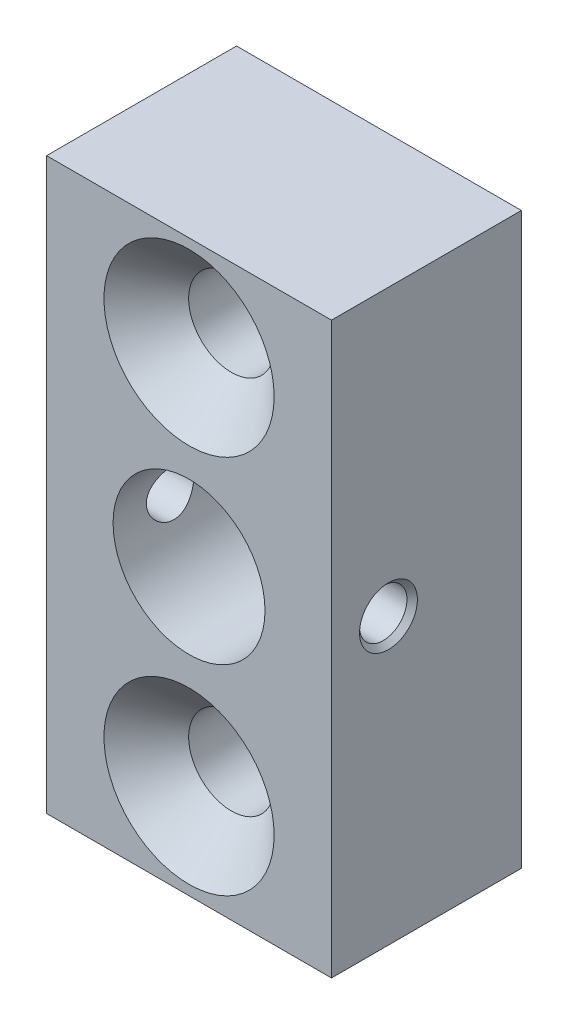
from build123d import *

# Parameters (mm, degrees)
SKIZZE1_W                             = 15
SKIZZE1_H                             = 30
AUFSATZ_LINEAR_AUSTRAGEN1_DEPTH       = 10
FORMSENKUNG_F_R_M4_SFHCS1_D           = 4.5
FORMSENKUNG_F_R_M4_SFHCS1_CSINK_D     = 8.96
FORMSENKUNG_F_R_M4_SFHCS1_CSINK_ANGLE = 90
SKIZZE4_R                             = 3.1
SCHNITT_LINEAR_AUSTRAGEN1_DEPTH       = 4
SKIZZE7_R                             = 4
SCHNITT_LINEAR_AUSTRAGEN2_DEPTH       = 6
M3X0_5_GEWINDEBOHRUNG1_D              = 2.5
M3X0_5_GEWINDEBOHRUNG1_CSINK_D        = 3.05
M3X0_5_GEWINDEBOHRUNG1_CSINK_ANGLE    = 90


with BuildPart() as part:
    # Skizze1 → Aufsatz-Linear austragen1 (new body)
    with BuildSketch(Plane.XY):
        with Locations((7.5, 15)):
            Rectangle(SKIZZE1_W, SKIZZE1_H)
    extrude(amount=AUFSATZ_LINEAR_AUSTRAGEN1_DEPTH)

    # Formsenkung für M4 SFHCS1 (through all)
    with Locations(Plane.XY.offset(10)):
        with Locations((7.5, 25), (7.5, 5)):
            CounterSinkHole(FORMSENKUNG_F_R_M4_SFHCS1_D / 2, FORMSENKUNG_F_R_M4_SFHCS1_CSINK_D / 2, counter_sink_angle=FORMSENKUNG_F_R_M4_SFHCS1_CSINK_ANGLE)

    # Skizze4 → Schnitt-Linear austragen1 (cut)
    with BuildSketch(Plane(origin=(0, 0, 0), x_dir=(-1, 0, 0), z_dir=(0, 0, -1))):
        with Locations((-7.5, 25)):
            Circle(SKIZZE4_R)
        with Locations((-7.5, 5)):
            Circle(SKIZZE4_R)
    extrude(amount=-SCHNITT_LINEAR_AUSTRAGEN1_DEPTH, mode=Mode.SUBTRACT)

    # Skizze7 → Schnitt-Linear austragen2 (cut)
    with BuildSketch(Plane.XY.offset(10)):
        with Locations((7.5, 15)):
            Circle(SKIZZE7_R)
    extrude(amount=-SCHNITT_LINEAR_AUSTRAGEN2_DEPTH, mode=Mode.SUBTRACT)

    # M3x0.5 Gewindebohrung1 (through all)
    with Locations(Plane(origin=(15, 0, 0), x_dir=(0, 0, -1), z_dir=(1, 0, 0))):
        with Locations((-7, 15)):
            CounterSinkHole(M3X0_5_GEWINDEBOHRUNG1_D / 2, M3X0_5_GEWINDEBOHRUNG1_CSINK_D / 2, counter_sink_angle=M3X0_5_GEWINDEBOHRUNG1_CSINK_ANGLE)


solid = part.part
